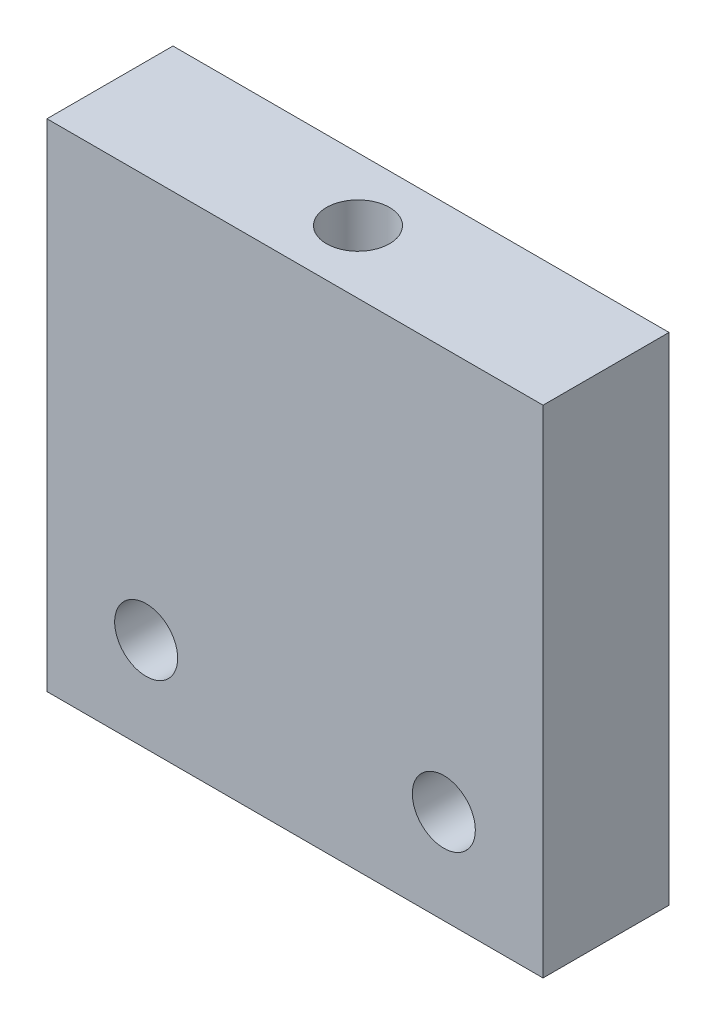
from build123d import *

# Parameters (mm, degrees)
SKETCH1_W           = 50
SKETCH1_H           = 12.7
BOSS_EXTRUDE1_DEPTH = 50
SKETCH4_R           = 3.175
CUT_EXTRUDE2_DEPTH  = 67.154773237
SKETCH5_R           = 3.175
CUT_EXTRUDE3_DEPTH  = 30
SKETCH6_W           = 5
SKETCH6_H           = 10
BOSS_EXTRUDE3_DEPTH = 5


with BuildPart() as part:
    # Sketch1 → Boss-Extrude1 (new body)
    with BuildSketch(Plane(origin=(0, 0, 0), x_dir=(1, 0, 0), z_dir=(0, 1, 0))):
        with Locations((-16.414538776, -6.35)):
            Rectangle(SKETCH1_W, SKETCH1_H)
    extrude(amount=BOSS_EXTRUDE1_DEPTH)

    # Sketch4 → Cut-Extrude2 (cut, through all)
    with BuildSketch(Plane.XY.offset(12.7)):
        with Locations((-1.414538776, 9.5)):
            Circle(SKETCH4_R)
        with Locations((-31.414538776, 9.5)):
            Circle(SKETCH4_R)
    extrude(amount=-CUT_EXTRUDE2_DEPTH, mode=Mode.SUBTRACT)

    # Sketch5 → Cut-Extrude3 (cut)
    with BuildSketch(Plane(origin=(0, 50, 0), x_dir=(1, 0, 0), z_dir=(0, 1, 0))):
        with Locations(Location((-16.414538776, -6.35, 0), (0, 0, 270))):
            Circle(SKETCH5_R)
    extrude(amount=-CUT_EXTRUDE3_DEPTH, mode=Mode.SUBTRACT)

    # Sketch6 → Boss-Extrude3 (add)
    with BuildSketch(Plane(origin=(0, 0, 0), x_dir=(-1, 0, 0), z_dir=(0, 0, -1))):
        with Locations((16.414538776, 25)):
            Rectangle(SKETCH6_W, SKETCH6_H)
    extrude(amount=BOSS_EXTRUDE3_DEPTH)


solid = part.part
